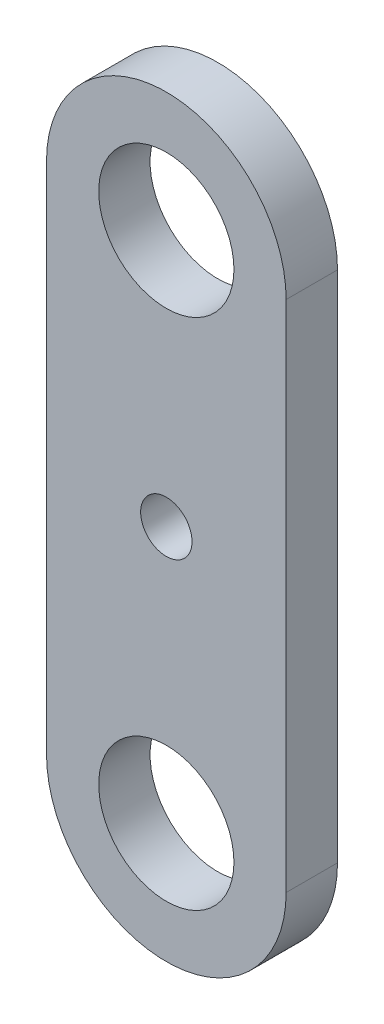
from build123d import *

# Parameters (mm, degrees)
SKETCH_1_R      = 7
SKETCH_1_R_2    = 3.95
SKETCH_1_R_3    = 1.5
EXTRUDE_1_DEPTH = 3


with BuildPart() as part:
    # 草图1 → 凸台-拉伸1 (new body)
    # profile 1 of 3: a face of its own
    with BuildSketch(Plane.XY):
        with Locations((0, 30)):
            Circle(SKETCH_1_R)
        with Locations((0, 30)):
            Circle(SKETCH_1_R_2, mode=Mode.SUBTRACT)
    # profile 2 of 3: a face of its own
    with BuildSketch(Plane.XY):
        with BuildLine():
            ThreePointArc((7, 30), (0, 23), (-7, 30))
            Line((-7, 30), (-7, 0))
            ThreePointArc((-7, 0), (0, 7), (7, 0))
            Line((7, 0), (7, 30))
        make_face()
        with Locations((0, 15)):
            Circle(SKETCH_1_R_3, mode=Mode.SUBTRACT)
    # profile 3 of 3: a face of its own
    with BuildSketch(Plane.XY):
        Circle(SKETCH_1_R)
        Circle(SKETCH_1_R_2, mode=Mode.SUBTRACT)
    extrude(amount=EXTRUDE_1_DEPTH)


solid = part.part
